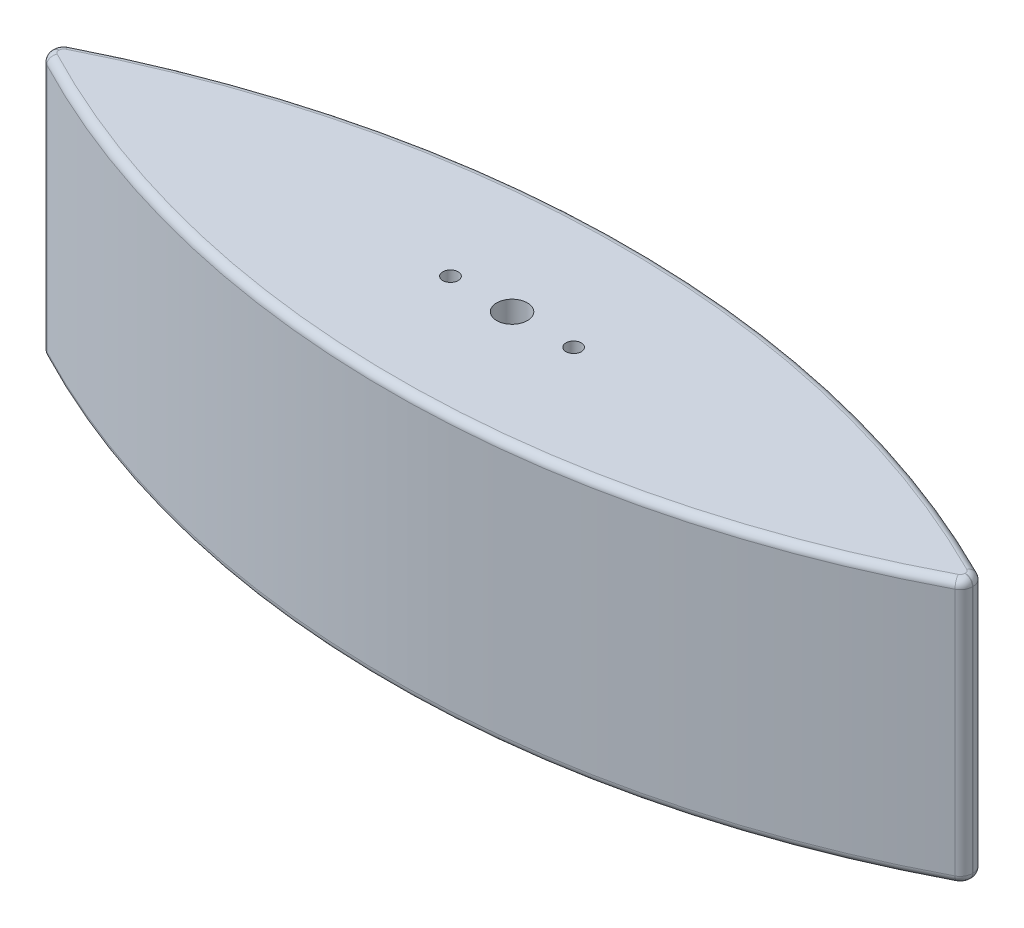
from build123d import *

# Parameters (mm, degrees)
BOSS_EXTRUDE1_DEPTH      = 28.575
BOSS_EXTRUDE1_DEPTH_BACK = 28.575
SKETCH1_W                = 190.049903163
SKETCH1_H                = 54.384002277
SKETCH2_W                = 210.421602417
SKETCH2_H                = 85.92215432
CUT_EXTRUDE1_DEPTH       = 200.732611311
SKETCH3_R                = 3.175
CUT_EXTRUDE2_DEPTH       = 200.28936731
FILLET1_R                = 2.54
FILLET2_R                = 1.5875
SKETCH4_R                = 1.5875
CUT_EXTRUDE3_DEPTH       = 12.7
CUT_EXTRUDE4_START       = -12.7
SKETCH5_R                = 1.5875
CUT_EXTRUDE4_DEPTH       = 12.7


with BuildPart() as part:
    # Sketch1 → Boss-Extrude1 (new, two sides: drawn at the far end of the back side and taken through both)
    with BuildSketch(Plane.XY.offset(-BOSS_EXTRUDE1_DEPTH_BACK)):
        with Locations((95.024951582, 192.335070701)):
            Rectangle(SKETCH1_W, SKETCH1_H)
    extrude(amount=BOSS_EXTRUDE1_DEPTH + BOSS_EXTRUDE1_DEPTH_BACK)

    # Sketch2 → Cut-Extrude1 (cut, through all)
    with BuildSketch(Plane(origin=(0, 219.527071839, 0), x_dir=(1, 0, 0), z_dir=(0, 1, 0))):
        with Locations((94.245612314, -0.876756677)):
            Rectangle(SKETCH2_W, SKETCH2_H)
        with BuildLine():
            Line((0, 1.5875), (0, -1.5875))
            ThreePointArc((0, -1.5875), (95.024951582, -25.291629574), (190.049903163, -1.5875))
            Line((190.049903163, -1.5875), (190.049903163, 1.5875))
            ThreePointArc((190.049903163, 1.5875), (95.024951582, 24.488158935), (0, 1.5875))
        make_face(mode=Mode.SUBTRACT)
    extrude(amount=-CUT_EXTRUDE1_DEPTH, mode=Mode.SUBTRACT)

    # Sketch3 → Cut-Extrude2 (cut, through all)
    with BuildSketch(Plane(origin=(0, 219.527071839, 0), x_dir=(1, 0, 0), z_dir=(0, 1, 0))):
        with Locations((95.024951582, 0)):
            Circle(SKETCH3_R)
    extrude(amount=-CUT_EXTRUDE2_DEPTH, mode=Mode.SUBTRACT)

    # Fillet1
    fillet1_edges = [part.edges().sort_by_distance(p)[0] for p in [
        (190.049903163, 192.3350707, -1.5875),
        (190.049903163, 192.3350707, 1.5875),
        (0, 192.3350707, -1.5875),
        (0, 192.3350707, 1.5875),
    ]]
    fillet(fillet1_edges, radius=FILLET1_R)

    # Fillet2
    fillet2_edges = [part.edges().sort_by_distance(p)[0] for p in [
        (0.367643144, 165.143069562, 1.371374897),
        (0, 165.143069562, 0.013840704),
        (0.378145075, 165.143069562, -1.36087226),
        (95.024951582, 165.143069562, -24.488158935),
        (189.671758089, 165.143069562, -1.36087226),
        (190.049903163, 165.143069562, 0.013840704),
        (189.68226002, 165.143069562, 1.371374897),
        (0.367643144, 219.527071839, 1.371374897),
        (0, 219.527071839, 0.013840704),
        (0.378145075, 219.527071839, -1.36087226),
        (95.024951582, 219.527071839, -24.488158935),
        (189.671758089, 219.527071839, -1.36087226),
        (190.049903163, 219.527071839, 0.013840704),
        (189.68226002, 219.527071839, 1.371374897),
        (95.024951582, 165.143069562, 25.291629574),
        (95.024951582, 219.527071839, 25.291629574),
    ]]
    fillet(fillet2_edges, radius=FILLET2_R)

    # Sketch4 → Cut-Extrude3 (cut)
    with BuildSketch(Plane(origin=(0, 219.527071839, 0), x_dir=(1, 0, 0), z_dir=(0, 1, 0))):
        with Locations((107.724951582, 0)):
            Circle(SKETCH4_R)
        with Locations((82.324951582, 0)):
            Circle(SKETCH4_R)
    extrude(amount=-CUT_EXTRUDE3_DEPTH, mode=Mode.SUBTRACT)

    # Sketch5 → Cut-Extrude4 (cut)
    with BuildSketch(Plane.XZ.offset(-165.143069562).offset(CUT_EXTRUDE4_START)):
        with Locations((82.324951582, 0)):
            Circle(SKETCH5_R)
        with Locations((107.724951582, 0)):
            Circle(SKETCH5_R)
    extrude(amount=CUT_EXTRUDE4_DEPTH, mode=Mode.SUBTRACT)


solid = part.part
